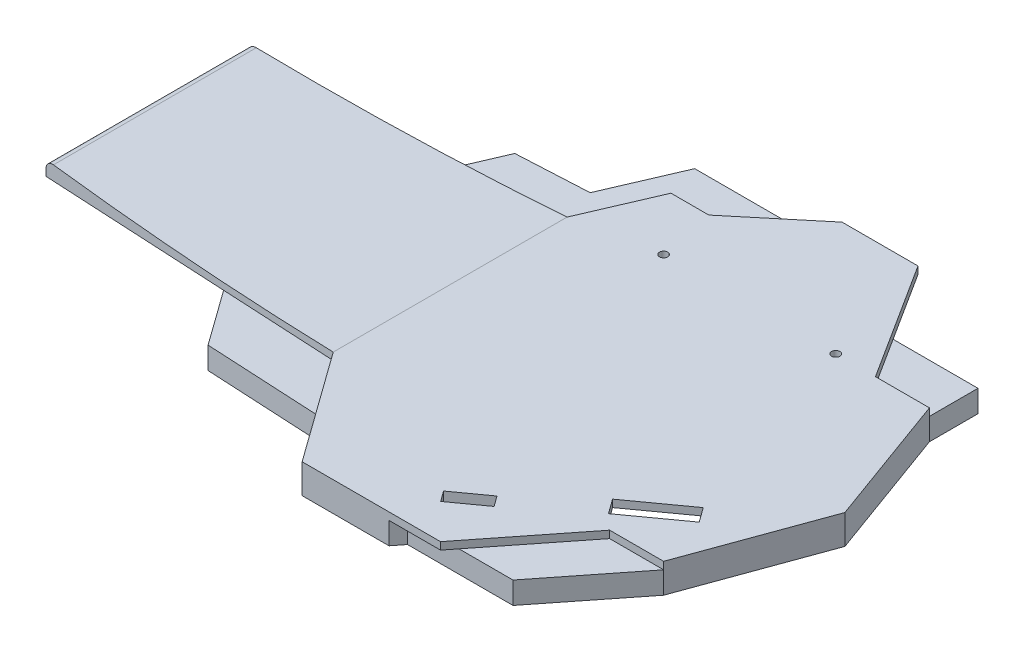
from build123d import *

# Parameters (mm, degrees)
EXTRUDE_1_DEPTH          = 2
EXTRUDE_2_DEPTH          = 2
CUT_EXTRUDE_3_DEPTH      = 202.869395429
CUT_EXTRUDE_3_DEPTH_BACK = 202.869395429
FILLET_1_R               = 2
EXTRUDE_4_DEPTH          = 6
HOLE_WIZARD_4_40_2_D     = 2.2606
CUT_EXTRUDE_7_DEPTH      = 202.98824919


with BuildPart() as part:
    # 草图2 → 凸台-拉伸1 (new body)
    with BuildSketch(Plane(origin=(0, 0, 0), x_dir=(1, 0, 0), z_dir=(0, 1, 0))):
        Polygon((141.821582241, 68.082690978), (121.161879345, 68.082690978), (101.35099463, 51.608897425), (91.039832206, 51.608897425), (82.527346571, 31.825074964), (0, 27.5), (0, -27.5), (82.527346571, -31.825074964), (104.14664553, -61.917309022), (141.821582241, -61.917309022), (162.133732132, -36.18552755), (176.829545061, -36.18552755), (190, 0), (176.829545061, 36.18552755), (162.133732132, 36.18552755), align=None)
    extrude(amount=EXTRUDE_1_DEPTH)

    # 草图6 → 凸台-拉伸2 (add)
    with BuildSketch(Plane(origin=(0, 2, 0), x_dir=(1, 0, 0), z_dir=(0, 1, 0))):
        Polygon((82.527346571, 31.825074964), (82.527346571, -31.825074964), (0, -27.5), (0, 27.5), align=None)
    extrude(amount=EXTRUDE_2_DEPTH)

    # 草图7 → 切除-拉伸3 (cut, two sides: drawn at the far end of the back side and taken through both)
    with BuildSketch(Plane.XY.offset(-CUT_EXTRUDE_3_DEPTH_BACK)):
        with BuildLine():
            Line((82.527346571, 2), (82.527346571, 30.740821148))
            Line((82.527346571, 30.740821148), (0, 4))
            add(Edge.make_bspline(
                [(82.527346571, 2), (41.215261335, 1.001172546), (0, 4)],
                knots=[0, 0, 0, 1, 1, 1], degree=2))
        make_face()
    extrude(amount=CUT_EXTRUDE_3_DEPTH + CUT_EXTRUDE_3_DEPTH_BACK, mode=Mode.SUBTRACT)

    # 圆角1
    fillet_1_edges = [part.edges().sort_by_distance(p)[0] for p in [
        (0, 4, 13.75),
    ]]
    fillet(fillet_1_edges, radius=FILLET_1_R)

    # 草图13 → 凸台-拉伸4 (add)
    with BuildSketch(Plane.XZ):
        Polygon((53.501507434, -30.303895193), (58.412275987, -41.716986195), (77.926898746, -42.739704237), (86.484415452, -62.62818317), (136.164724768, -62.62818317), (144.584081331, -49.40685536), (176.829545061, -49.40685536), (176.829545061, -36.18552755), (190, 0), (176.829545061, 36.18552755), (158.743204348, 59.097615602), (130.016377906, 59.097615602), (127.790568727, 61.917309022), (104.14664553, 61.917309022), (93.336996051, 46.871191993), (61.845926158, 45.220814953), (51.036276678, 30.174697924), (171.852914921, 31.825074964), (171.852914921, -31.825074964), align=None)
    extrude(amount=EXTRUDE_4_DEPTH)

    # #4-40 螺纹孔2 (through all)
    with Locations(Plane(origin=(0, 2, 0), x_dir=(1, 0, 0), z_dir=(0, 1, 0))):
        with Locations((151.351021218, 36.159959894), (104.497931561, 36.159959894)):
            Hole(HOLE_WIZARD_4_40_2_D / 2)

    # 草图18 → 切除-拉伸7 (cut, through all)
    with BuildSketch(Plane(origin=(0, 2, 0), x_dir=(1, 0, 0), z_dir=(0, 1, 0))):
        Polygon((169.563862496, -18.125868021), (155.218286362, -28.471875769), (158.085778721, -32.447885738), (172.431354854, -22.101877989), align=None)
        Polygon((130.302091903, -49.564637909), (132.361562224, -52.420260001), (140.814695434, -46.323873151), (138.755225113, -43.468251059), align=None)
    extrude(amount=-CUT_EXTRUDE_7_DEPTH, mode=Mode.SUBTRACT)


solid = part.part
